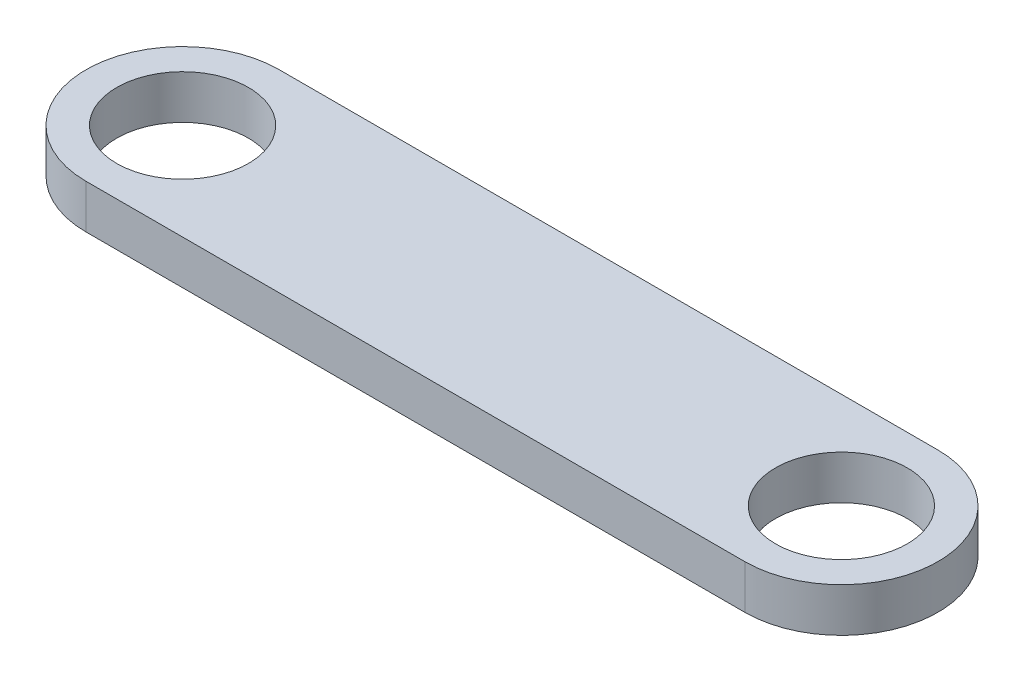
from build123d import *

# Parameters (mm, degrees)
ESQUISSE1_R        = 1.5
BOSS_EXTRU_1_DEPTH = 1


with BuildPart() as part:
    # Esquisse1 → Boss.-Extru.1 (new body)
    with BuildSketch(Plane(origin=(0, 0, 0), x_dir=(1, 0, 0), z_dir=(0, 1, 0))):
        with BuildLine():
            Line((-7.5, 2.2), (7.5, 2.2))
            ThreePointArc((7.5, 2.2), (9.7, 0), (7.5, -2.2))
            Line((7.5, -2.2), (-7.5, -2.2))
            ThreePointArc((-7.5, -2.2), (-9.7, 0), (-7.5, 2.2))
        make_face()
        with Locations(Location((-7.5, 0, 0), (0, 0, 270))):
            Circle(ESQUISSE1_R, mode=Mode.SUBTRACT)
        with Locations(Location((7.5, 0, 0), (0, 0, 270))):
            Circle(ESQUISSE1_R, mode=Mode.SUBTRACT)
    extrude(amount=BOSS_EXTRU_1_DEPTH)


solid = part.part
